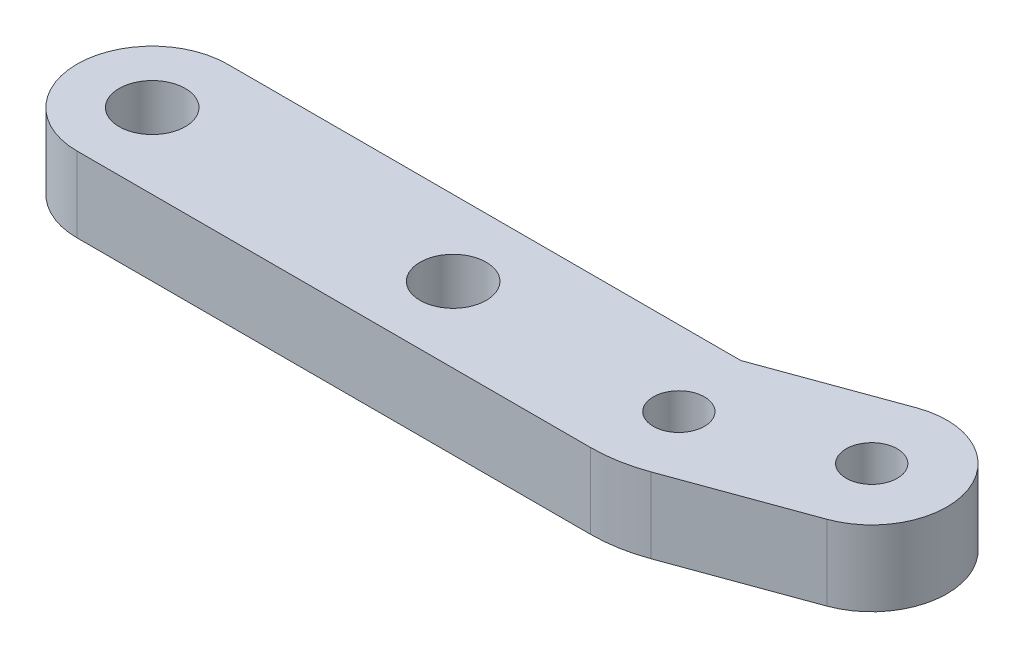
from build123d import *

# Parameters (mm, degrees)
SKETCH_1_R      = 2.2
SKETCH_1_R_2    = 1.7
EXTRUDE_1_DEPTH = 5


with BuildPart() as part:
    # 草图1 → 凸台-拉伸1 (new body)
    with BuildSketch(Plane(origin=(0, 0, 0), x_dir=(1, 0, 0), z_dir=(0, 1, 0))):
        with BuildLine():
            Line((0, 5), (34.118365096, 5))
            Line((34.118365096, 5), (42.686825491, 8.118664537))
            ThreePointArc((42.686825491, 8.118664537), (49.095389312, 5.13030215), (46.107026924, -1.278261671))
            Line((46.107026924, -1.278261671), (37.53856653, -4.396926208))
            ThreePointArc((37.53856653, -4.396926208), (35.854846873, -4.84807753), (34.118365096, -5))
            Line((34.118365096, -5), (0, -5))
            ThreePointArc((0, -5), (-5, 0), (0, 5))
        make_face()
        with Locations(Location((0, 0, 0), (0, 0, 270))):
            Circle(SKETCH_1_R, mode=Mode.SUBTRACT)
        with Locations(Location((20, 0, 0), (0, 0, 270))):
            Circle(SKETCH_1_R, mode=Mode.SUBTRACT)
        with Locations(Location((35, 0, 0), (0, 0, 270))):
            Circle(SKETCH_1_R_2, mode=Mode.SUBTRACT)
        with Locations(Location((44.396926208, 3.420201433, 0), (0, 0, 270))):
            Circle(SKETCH_1_R_2, mode=Mode.SUBTRACT)
    extrude(amount=EXTRUDE_1_DEPTH)


solid = part.part
